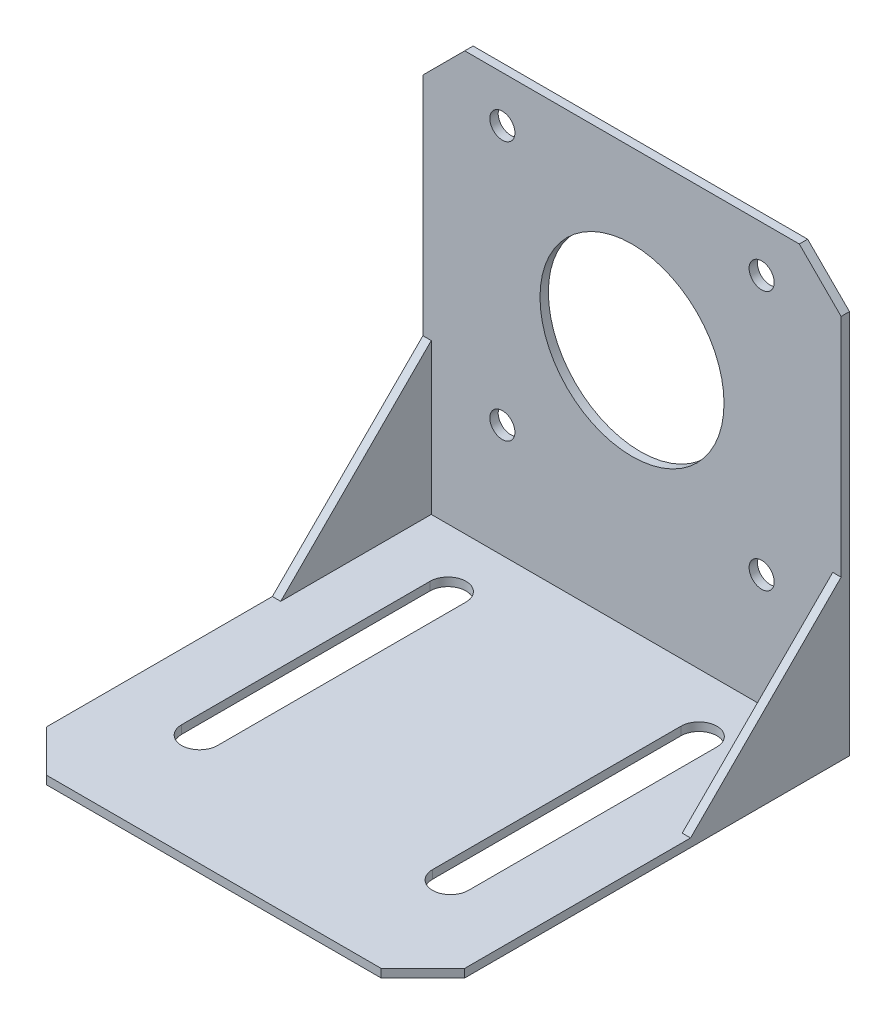
from build123d import *

# Parameters (mm, degrees)
EXTRUDE_2_DEPTH = 1
SKETCH_4_R      = 11
SKETCH_4_R_2    = 1.5
EXTRUDE_3_DEPTH = 1
EXTRUDE_4_DEPTH = 1
EXTRUDE_5_DEPTH = 1


with BuildPart() as part:
    # 草图3 → 凸台-拉伸2 (new body)
    with BuildSketch(Plane(origin=(0, 0, 0), x_dir=(1, 0, 0), z_dir=(0, 1, 0))):
        Polygon((-25, -20.5), (-20, -25.5), (20, -25.5), (25, -20.5), (25, 25.5), (-25, 25.5), align=None)
        with BuildLine():
            Line((-12.85, 17.5), (-12.85, -12.2))
            ThreePointArc((-12.85, -12.2), (-15, -14.35), (-17.15, -12.2))
            Line((-17.15, -12.2), (-17.15, 17.5))
            ThreePointArc((-17.15, 17.5), (-15, 19.65), (-12.85, 17.5))
        make_face(mode=Mode.SUBTRACT)
        with BuildLine():
            Line((17.15, 17.5), (17.15, -12.2))
            ThreePointArc((17.15, -12.2), (15, -14.35), (12.85, -12.2))
            Line((12.85, -12.2), (12.85, 17.5))
            ThreePointArc((12.85, 17.5), (15, 19.65), (17.15, 17.5))
        make_face(mode=Mode.SUBTRACT)
    extrude(amount=EXTRUDE_2_DEPTH)

    # 草图4 → 凸台-拉伸3 (add)
    with BuildSketch(Plane(origin=(0, 0, -25.5), x_dir=(-1, 0, 0), z_dir=(0, 0, -1))):
        Polygon((-20, 51), (20, 51), (25, 46), (25, 0), (-25, 0), (-25, 46), align=None)
        with Locations((0, 30)):
            Circle(SKETCH_4_R, mode=Mode.SUBTRACT)
        with Locations((-15.5, 45.5)):
            Circle(SKETCH_4_R_2, mode=Mode.SUBTRACT)
        with Locations((15.5, 45.5)):
            Circle(SKETCH_4_R_2, mode=Mode.SUBTRACT)
        with Locations((15.5, 14.5)):
            Circle(SKETCH_4_R_2, mode=Mode.SUBTRACT)
        with Locations((-15.5, 14.5)):
            Circle(SKETCH_4_R_2, mode=Mode.SUBTRACT)
    extrude(amount=-EXTRUDE_3_DEPTH)

    # 草图5 → 凸台-拉伸4 (add)
    with BuildSketch(Plane.ZY.offset(25)):
        Polygon((-25.5, 20), (-25.5, 0), (-5.5, 0), align=None)
    extrude(amount=-EXTRUDE_4_DEPTH)

    # 草图6 → 凸台-拉伸5 (add)
    with BuildSketch(Plane(origin=(25, 0, 0), x_dir=(0, 0, -1), z_dir=(1, 0, 0))):
        Polygon((25.5, 20), (25.5, 0), (5.5, 0), align=None)
    extrude(amount=-EXTRUDE_5_DEPTH)


solid = part.part
